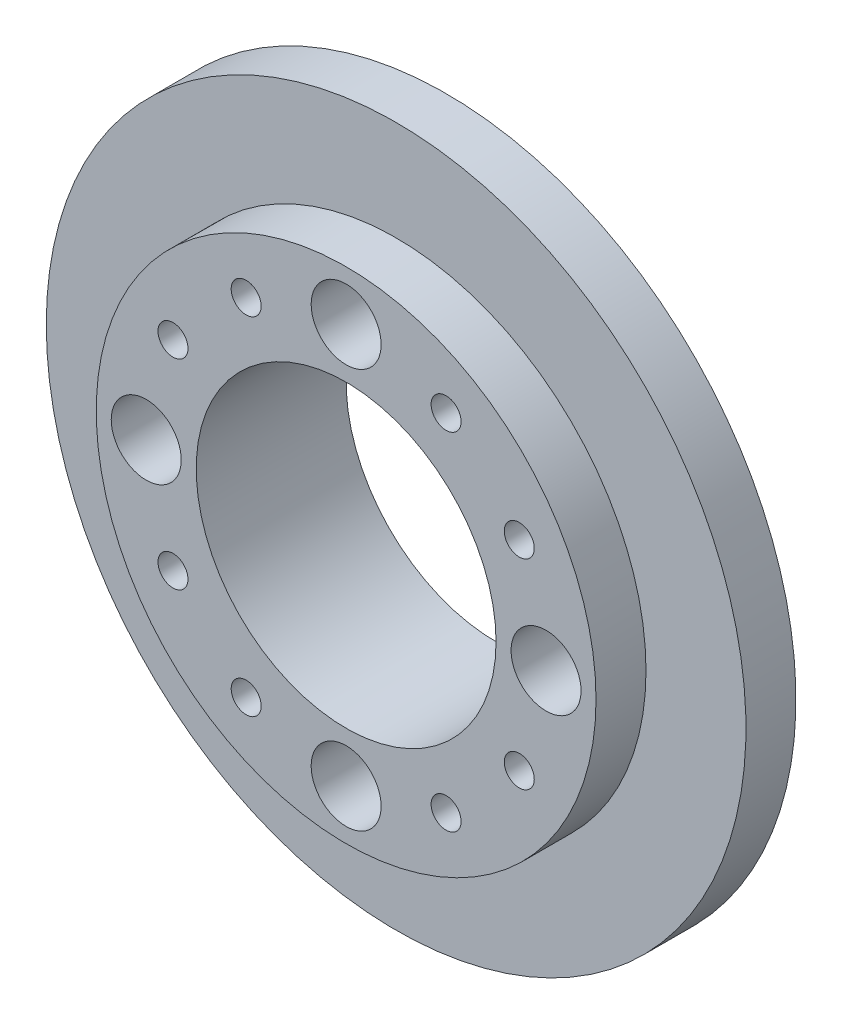
from build123d import *

# Parameters (mm, degrees)
SKETCH1_R               = 12.5
BOSS_EXTRUDE1_DEPTH     = 2.5
SKETCH3_R               = 17.5
BOSS_EXTRUDE2_DEPTH     = 2.5
BOSS_EXTRUDE3_START     = 2.5
SKETCH5_R               = 12.5
BOSS_EXTRUDE3_DEPTH     = 2.5
CUT_EXTRUDE1_DEPTH      = 26.860201082
CUT_EXTRUDE1_DEPTH_BACK = 26.860201082
SKETCH2_R               = 0.75
SKETCH2_R_2             = 7.5
SKETCH6_R               = 1.75
CUT_EXTRUDE2_DEPTH      = 10


with BuildPart() as part:
    # Sketch1 → Boss-Extrude1 (new body)
    with BuildSketch(Plane.XY):
        Circle(SKETCH1_R)
    extrude(amount=BOSS_EXTRUDE1_DEPTH)

    # Sketch3 → Boss-Extrude2 (add)
    with BuildSketch(Plane(origin=(0, 0, 0), x_dir=(-1, 0, 0), z_dir=(0, 0, -1))):
        Circle(SKETCH3_R)
    extrude(amount=BOSS_EXTRUDE2_DEPTH)

    # Sketch5 → Boss-Extrude3 (add)
    with BuildSketch(Plane(origin=(0, 0, -2.5), x_dir=(-1, 0, 0), z_dir=(0, 0, -1)).offset(BOSS_EXTRUDE3_START)):
        with Locations(Location((0, 0, 0), (0, 0, 180))):
            Circle(SKETCH5_R)
    extrude(amount=-BOSS_EXTRUDE3_DEPTH)

    # Sketch2 → Cut-Extrude1 (cut, two sides: drawn at the far end of the back side and taken through both)
    with BuildSketch(Plane.XY.offset(2.5).offset(-CUT_EXTRUDE1_DEPTH_BACK)):
        with Locations((0, 10)):
            Circle(SKETCH2_R)
        with Locations((5, 8.660254038)):
            Circle(SKETCH2_R)
        with Locations((8.660254038, 5)):
            Circle(SKETCH2_R)
        with Locations((10, 0)):
            Circle(SKETCH2_R)
        with Locations((8.660254038, -5)):
            Circle(SKETCH2_R)
        with Locations((5, -8.660254038)):
            Circle(SKETCH2_R)
        with Locations((0, -10)):
            Circle(SKETCH2_R)
        with Locations((-5, -8.660254038)):
            Circle(SKETCH2_R)
        with Locations((-8.660254038, -5)):
            Circle(SKETCH2_R)
        with Locations((-10, 0)):
            Circle(SKETCH2_R)
        with Locations((-8.660254038, 5)):
            Circle(SKETCH2_R)
        with Locations((-5, 8.660254038)):
            Circle(SKETCH2_R)
        Circle(SKETCH2_R_2)
    extrude(amount=CUT_EXTRUDE1_DEPTH + CUT_EXTRUDE1_DEPTH_BACK, mode=Mode.SUBTRACT)

    # Sketch6 → Cut-Extrude2 (cut)
    with BuildSketch(Plane(origin=(0, 0, -5), x_dir=(-1, 0, 0), z_dir=(0, 0, -1))):
        with Locations((0, 10)):
            Circle(SKETCH6_R)
        with Locations((10, 0)):
            Circle(SKETCH6_R)
        with Locations((0, -10)):
            Circle(SKETCH6_R)
        with Locations((-10, 0)):
            Circle(SKETCH6_R)
    extrude(amount=-CUT_EXTRUDE2_DEPTH, mode=Mode.SUBTRACT)


solid = part.part
